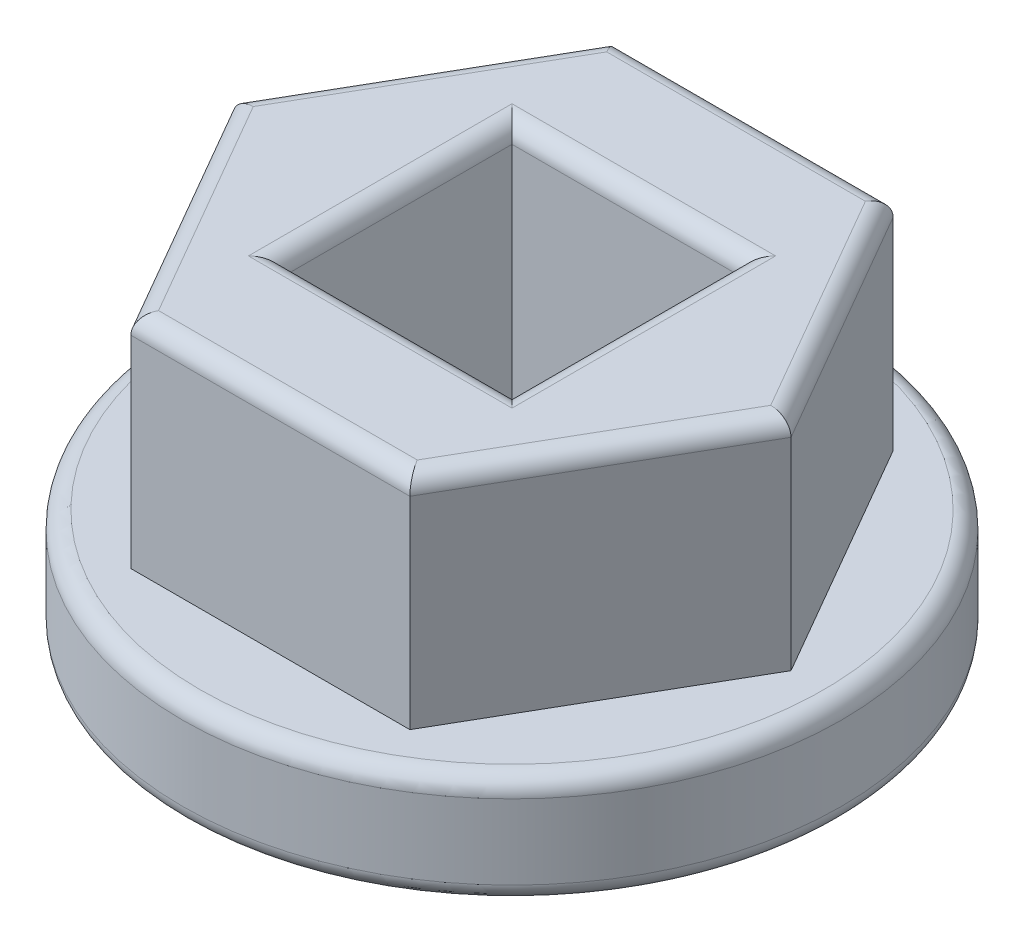
from build123d import *

# Parameters (mm, degrees)
SKETCH1_W           = 6.604
SKETCH1_H           = 6.604
BOSS_EXTRUDE1_DEPTH = 6.35
SKETCH2_R           = 9.525
SKETCH2_W           = 6.604
SKETCH2_H           = 6.604
BOSS_EXTRUDE2_DEPTH = 3.175
FILLET1_R           = 0.508


with BuildPart() as part:
    # Sketch1 → Boss-Extrude1 (new body)
    with BuildSketch(Plane(origin=(0, 0, 0), x_dir=(1, 0, 0), z_dir=(0, 1, 0))):
        Polygon((8.065583261, 0), (4.03279163, 6.985), (-4.03279163, 6.985), (-8.065583261, 0), (-4.03279163, -6.985), (4.03279163, -6.985), align=None)
        Rectangle(SKETCH1_W, SKETCH1_H, mode=Mode.SUBTRACT)
    extrude(amount=BOSS_EXTRUDE1_DEPTH)

    # Sketch2 → Boss-Extrude2 (add)
    with BuildSketch(Plane.XZ):
        with Locations(Location((0, 0, 0), (0, 0, 270))):
            Circle(SKETCH2_R)
        Rectangle(SKETCH2_W, SKETCH2_H, mode=Mode.SUBTRACT)
    extrude(amount=BOSS_EXTRUDE2_DEPTH)

    # Fillet1
    fillet1_edges = [part.edges().sort_by_distance(p)[0] for p in [
        (0, 6.35, -6.985),
        (-6.049187445, 6.35, -3.4925),
        (-6.049187445, 6.35, 3.4925),
        (3.302, 6.35, 0),
        (0, 6.35, -3.302),
        (-3.302, 6.35, 0),
        (0, 6.35, 3.302),
        (0, 6.35, 6.985),
        (0, -3.175, 9.525),
        (0, 0, 9.525),
        (3.302, -3.175, 0),
        (0, -3.175, 3.302),
        (-3.302, -3.175, 0),
        (0, -3.175, -3.302),
        (6.049187445, 6.35, 3.4925),
        (6.049187445, 6.35, -3.4925),
    ]]
    fillet(fillet1_edges, radius=FILLET1_R)


solid = part.part
